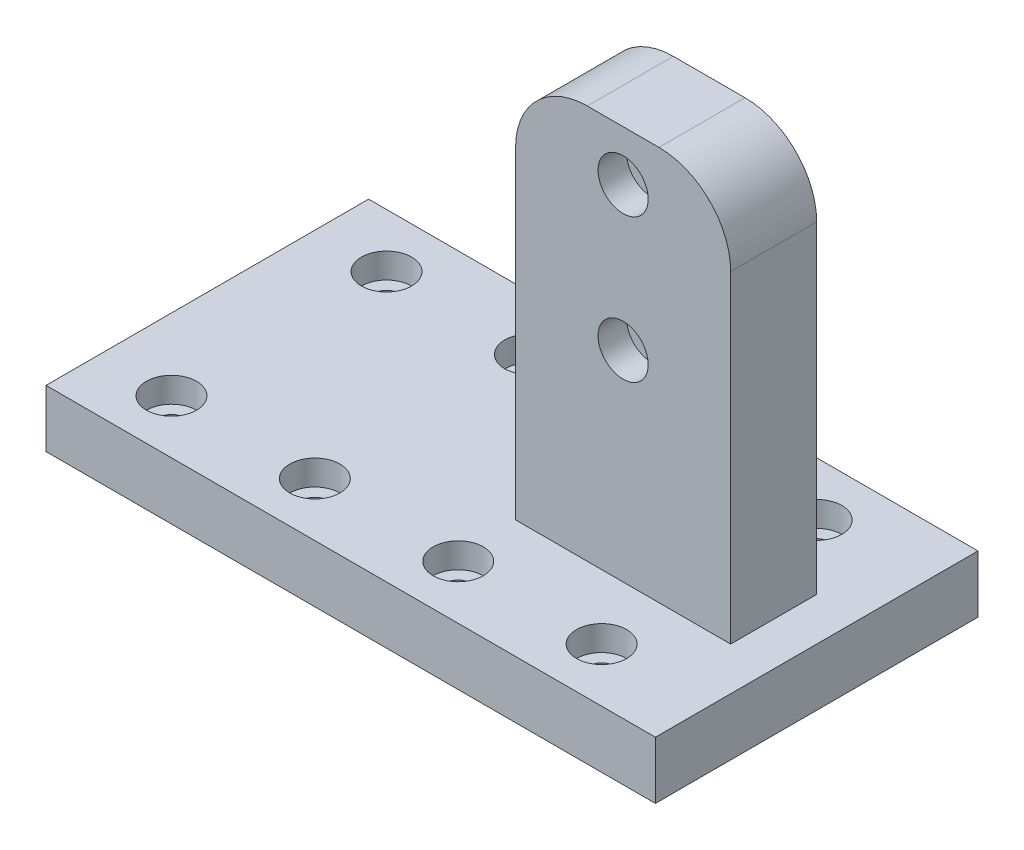
from build123d import *

# Parameters (mm, degrees)
SKETCH1_W           = 100
SKETCH1_H           = 45
BOSS_EXTRUDE1_DEPTH = 8
SKETCH2_R           = 1.75
CUT_EXTRUDE1_DEPTH  = 8
SKETCH3_R           = 3.5
CUT_EXTRUDE2_DEPTH  = 3.5
SKETCH4_W           = 30
SKETCH4_H           = 12
BOSS_EXTRUDE2_DEPTH = 55
SKETCH7_W           = 15
SKETCH7_H           = 45
CUT_EXTRUDE4_DEPTH  = 8
SKETCH9_R           = 1.75
CUT_EXTRUDE6_DEPTH  = 12
FILLET1_R           = 10
FILLET2_R           = 10
SKETCH10_R          = 3.5
CUT_EXTRUDE7_DEPTH  = 4


with BuildPart() as part:
    # Sketch1 → Boss-Extrude1 (new body)
    with BuildSketch(Plane(origin=(0, 0, 0), x_dir=(1, 0, 0), z_dir=(0, 1, 0))):
        Rectangle(SKETCH1_W, SKETCH1_H)
    extrude(amount=BOSS_EXTRUDE1_DEPTH)

    # Sketch2 → Cut-Extrude1 (cut)
    with BuildSketch(Plane(origin=(0, 8, 0), x_dir=(1, 0, 0), z_dir=(0, 1, 0))):
        with Locations(Location((20, 15, 0), (0, 0, 270))):
            Circle(SKETCH2_R)
        with Locations(Location((20, -15, 0), (0, 0, 270))):
            Circle(SKETCH2_R)
        with Locations(Location((0, 15, 0), (0, 0, 270))):
            Circle(SKETCH2_R)
        with Locations(Location((0, -15, 0), (0, 0, 270))):
            Circle(SKETCH2_R)
        with Locations(Location((-20, 15, 0), (0, 0, 270))):
            Circle(SKETCH2_R)
        with Locations(Location((-20, -15, 0), (0, 0, 270))):
            Circle(SKETCH2_R)
        with Locations(Location((-40, 15, 0), (0, 0, 270))):
            Circle(SKETCH2_R)
        with Locations(Location((-40, -15, 0), (0, 0, 270))):
            Circle(SKETCH2_R)
    extrude(amount=-CUT_EXTRUDE1_DEPTH, mode=Mode.SUBTRACT)

    # Sketch3 → Cut-Extrude2 (cut)
    with BuildSketch(Plane(origin=(0, 8, 0), x_dir=(1, 0, 0), z_dir=(0, 1, 0))):
        with Locations(Location((-40, 15, 0), (0, 0, 270))):
            Circle(SKETCH3_R)
        with Locations(Location((-20, 15, 0), (0, 0, 270))):
            Circle(SKETCH3_R)
        with Locations(Location((0, 15, 0), (0, 0, 270))):
            Circle(SKETCH3_R)
        with Locations(Location((20, 15, 0), (0, 0, 270))):
            Circle(SKETCH3_R)
        with Locations(Location((-40, -15, 0), (0, 0, 270))):
            Circle(SKETCH3_R)
        with Locations(Location((-20, -15, 0), (0, 0, 270))):
            Circle(SKETCH3_R)
        with Locations(Location((0, -15, 0), (0, 0, 270))):
            Circle(SKETCH3_R)
        with Locations(Location((20, -15, 0), (0, 0, 270))):
            Circle(SKETCH3_R)
    extrude(amount=-CUT_EXTRUDE2_DEPTH, mode=Mode.SUBTRACT)

    # Sketch4 → Boss-Extrude2 (add)
    with BuildSketch(Plane(origin=(0, 8, 0), x_dir=(1, 0, 0), z_dir=(0, 1, 0))):
        with Locations((14, 0)):
            Rectangle(SKETCH4_W, SKETCH4_H)
    extrude(amount=BOSS_EXTRUDE2_DEPTH)

    # Sketch7 → Cut-Extrude4 (cut)
    with BuildSketch(Plane(origin=(0, 8, 0), x_dir=(1, 0, 0), z_dir=(0, 1, 0))):
        with Locations((42.5, 0)):
            Rectangle(SKETCH7_W, SKETCH7_H)
    extrude(amount=-CUT_EXTRUDE4_DEPTH, mode=Mode.SUBTRACT)

    # Sketch9 → Cut-Extrude6 (cut)
    with BuildSketch(Plane(origin=(0, 0, -6), x_dir=(-1, 0, 0), z_dir=(0, 0, -1))):
        with Locations((-14, 56)):
            Circle(SKETCH9_R)
        with Locations((-14, 36)):
            Circle(SKETCH9_R)
    extrude(amount=-CUT_EXTRUDE6_DEPTH, mode=Mode.SUBTRACT)

    # Fillet1
    fillet1_edges = [part.edges().sort_by_distance(p)[0] for p in [
        (29, 63, 0),
    ]]
    fillet(fillet1_edges, radius=FILLET1_R)

    # Fillet2
    fillet2_edges = [part.edges().sort_by_distance(p)[0] for p in [
        (-1, 63, 0),
    ]]
    fillet(fillet2_edges, radius=FILLET2_R)

    # Sketch10 → Cut-Extrude7 (cut)
    with BuildSketch(Plane.XY.offset(6)):
        with Locations((14, 36)):
            Circle(SKETCH10_R)
        with Locations((14, 56)):
            Circle(SKETCH10_R)
    extrude(amount=-CUT_EXTRUDE7_DEPTH, mode=Mode.SUBTRACT)


solid = part.part
